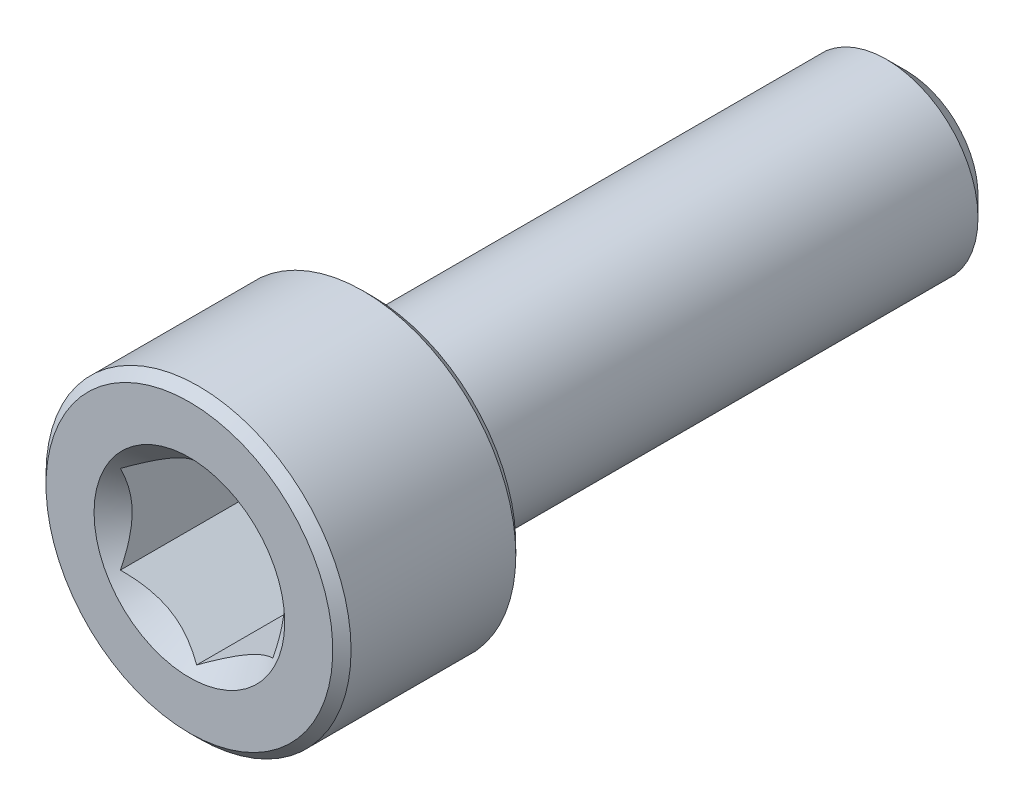
from build123d import *

# Parameters (mm, degrees)
CUT_EXTRUDE1_DEPTH  = 5
SKETCH4_R           = 3.125
CUT_EXTRUDE2_DEPTH  = 3
CUT_EXTRUDE2_DRAFT  = -45
SKETCH12_R          = 3
BOSS_EXTRUDE1_DEPTH = 2.5


with BuildPart() as part:
    # Sketch2 → Revolve1 (revolve)
    with BuildSketch(Plane(origin=(0, 0, 0), x_dir=(0, 0, -1), z_dir=(1, 0, 0))):
        with BuildLine():
            Line((-10.5, 0), (-10.5, 4.7))
            Line((-10.5, 4.7), (-10.2, 5))
            Line((-10.2, 5), (-4.8, 5))
            Line((-4.8, 5), (-4.5, 4.7))
            Line((-4.5, 4.7), (-4.5, 3.3))
            ThreePointArc((-4.5, 3.3), (-4.412132034, 3.087867966), (-4.2, 3))
            Line((-4.2, 3), (9.850480947, 3))
            Line((9.850480947, 3), (10.5, 2.350480947))
            Line((10.5, 2.350480947), (10.5, 0))
            Line((10.5, 0), (-10.5, 0))
        make_face()
    revolve(axis=Axis((0, 0, -10.5), (0, 0, 1)))

    # Sketch3 → Cut-Extrude1 (cut)
    with BuildSketch(Plane.XY.offset(10.5)):
        Polygon((2.5, -1.443375673), (2.5, 1.443375673), (0, 2.886751346), (-2.5, 1.443375673), (-2.5, -1.443375673), (0, -2.886751346), align=None)
    extrude(amount=-CUT_EXTRUDE1_DEPTH, mode=Mode.SUBTRACT)


with BuildPart() as cut_extrude2_tool:
    # Sketch4 → Cut-Extrude2 (with draft: the straight prism first)
    with BuildSketch(Plane.XY.offset(10.5)):
        Circle(SKETCH4_R)
    extrude(amount=-CUT_EXTRUDE2_DEPTH)
    # Cut-Extrude2: the draft: its side faces are tilted about the plane it starts from
    cut_extrude2_sides = [cut_extrude2_tool.faces().sort_by_distance(p)[0] for p in [
        (-3.125, 0, 9),
    ]]
    draft(cut_extrude2_sides, Plane.XY.offset(10.5), CUT_EXTRUDE2_DRAFT)


with BuildPart() as part_1:
    add(part.part)

    # Cut-Extrude2: cut by cut_extrude2_tool
    add(cut_extrude2_tool.part, mode=Mode.SUBTRACT)


with BuildPart() as body_2:
    # Split1: the piece on the far side of the plane
    add(part_1.part)
    split(bisect_by=Plane.XY, keep=Keep.BOTTOM)


with BuildPart() as part_2:
    add(part_1.part)

    # Split1
    split(bisect_by=Plane.XY, keep=Keep.TOP)



with BuildPart() as body_2_1:
    # Body-Move/Copy1: moved
    add(body_2.part.moved(Location((0, 0, -2.5))))


with BuildPart() as part_3:
    add(part_2.part)

    add(body_2_1.part)  # Boss-Extrude1 merges body 2
    # Sketch12 → Boss-Extrude1 (add)
    with BuildSketch(Plane.XY.offset(-2.5)):
        with Locations(Location((0, 0, 0), (0, 0, 90))):
            Circle(SKETCH12_R)
    extrude(amount=BOSS_EXTRUDE1_DEPTH)


solid = part_3.part
